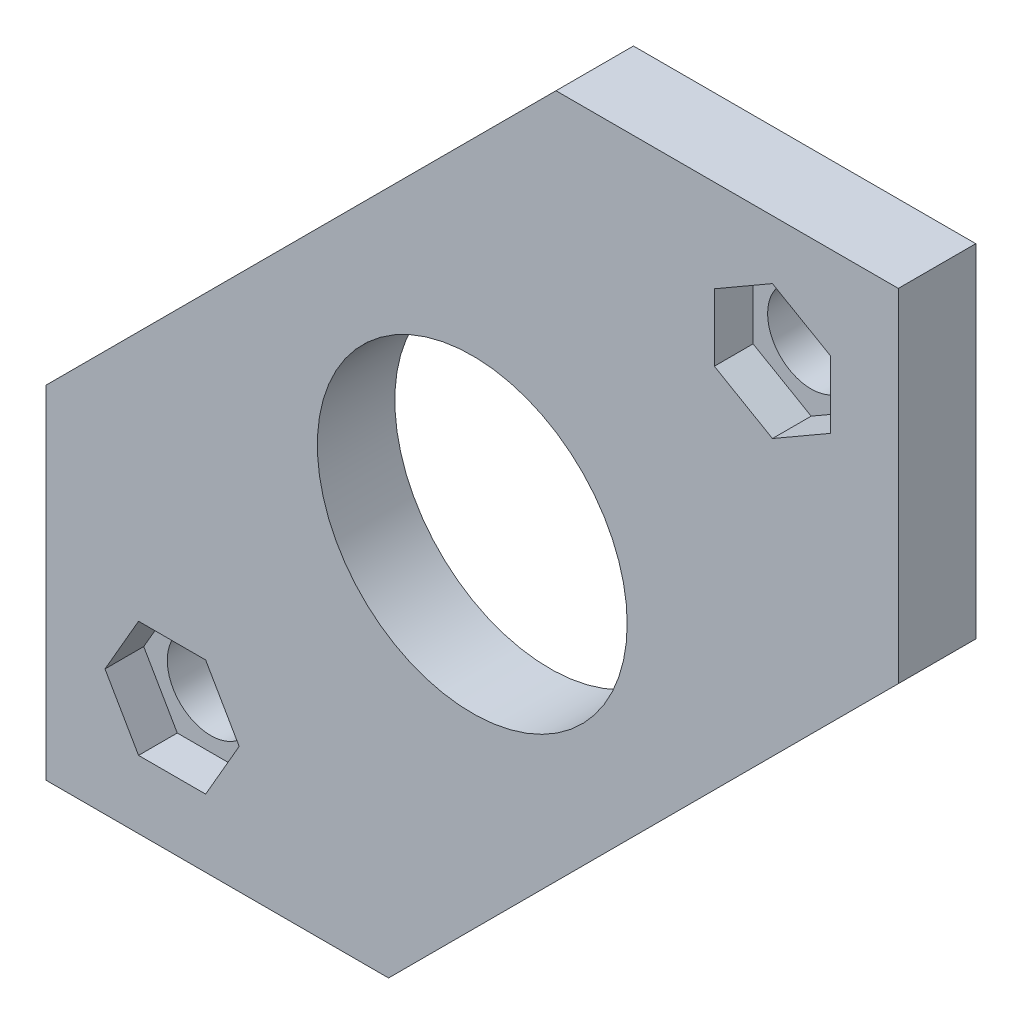
from build123d import *

# Parameters (mm, degrees)
SKETCH1_R           = 8
SKETCH1_R_2         = 2.25
BOSS_EXTRUDE1_DEPTH = 4
CUT_EXTRUDE1_DEPTH  = 2


with BuildPart() as part:
    # Sketch1 → Boss-Extrude1 (new body)
    with BuildSketch(Plane.XY):
        Polygon((-4.32233047, -22), (-22, -22), (-22, -4.32233047), (4.32233047, 22), (22, 22), (22, 4.32233047), align=None)
        Circle(SKETCH1_R, mode=Mode.SUBTRACT)
        with Locations((-15.5, -15.5)):
            Circle(SKETCH1_R_2, mode=Mode.SUBTRACT)
        with Locations((15.5, 15.5)):
            Circle(SKETCH1_R_2, mode=Mode.SUBTRACT)
    extrude(amount=BOSS_EXTRUDE1_DEPTH)

    # Sketch2 → Cut-Extrude1 (cut)
    with BuildSketch(Plane.XY.offset(4)):
        Polygon((-18.964101615, -15.5), (-17.232050808, -18.5), (-13.767949192, -18.5), (-12.035898385, -15.5), (-13.767949192, -12.5), (-17.232050808, -12.5), align=None)
        Polygon((12.5, 13.767949192), (12.5, 17.232050808), (15.5, 18.964101615), (18.5, 17.232050808), (18.5, 13.767949192), (15.5, 12.035898385), align=None)
    extrude(amount=-CUT_EXTRUDE1_DEPTH, mode=Mode.SUBTRACT)


solid = part.part
